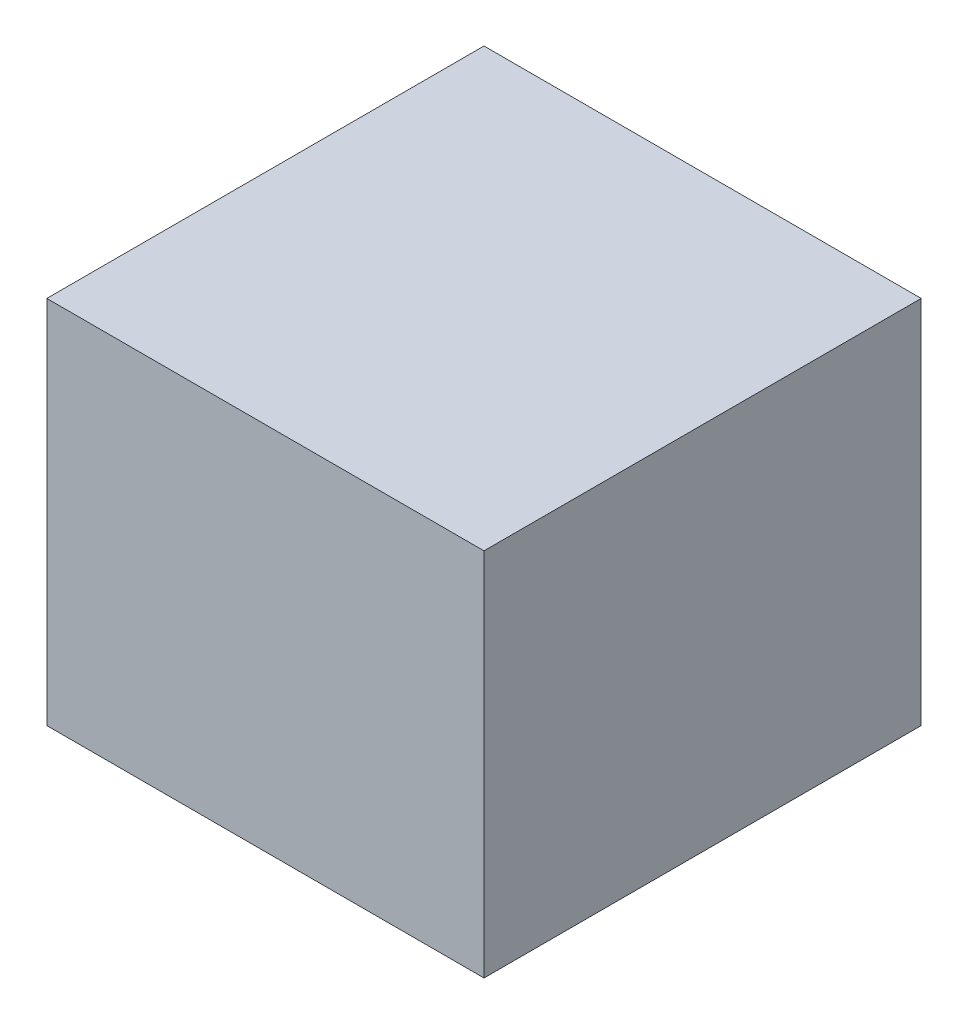
from build123d import *

# Parameters (mm, degrees)
SKETCH1_W           = 330.2
SKETCH1_H           = 330.2
BOSS_EXTRUDE1_DEPTH = 279.4


with BuildPart() as part:
    # Sketch1 → Boss-Extrude1 (new body)
    with BuildSketch(Plane(origin=(0, 0, 0), x_dir=(1, 0, 0), z_dir=(0, 1, 0))):
        with Locations((144.62248062, -9.598837209)):
            Rectangle(SKETCH1_W, SKETCH1_H)
    extrude(amount=BOSS_EXTRUDE1_DEPTH)


solid = part.part
